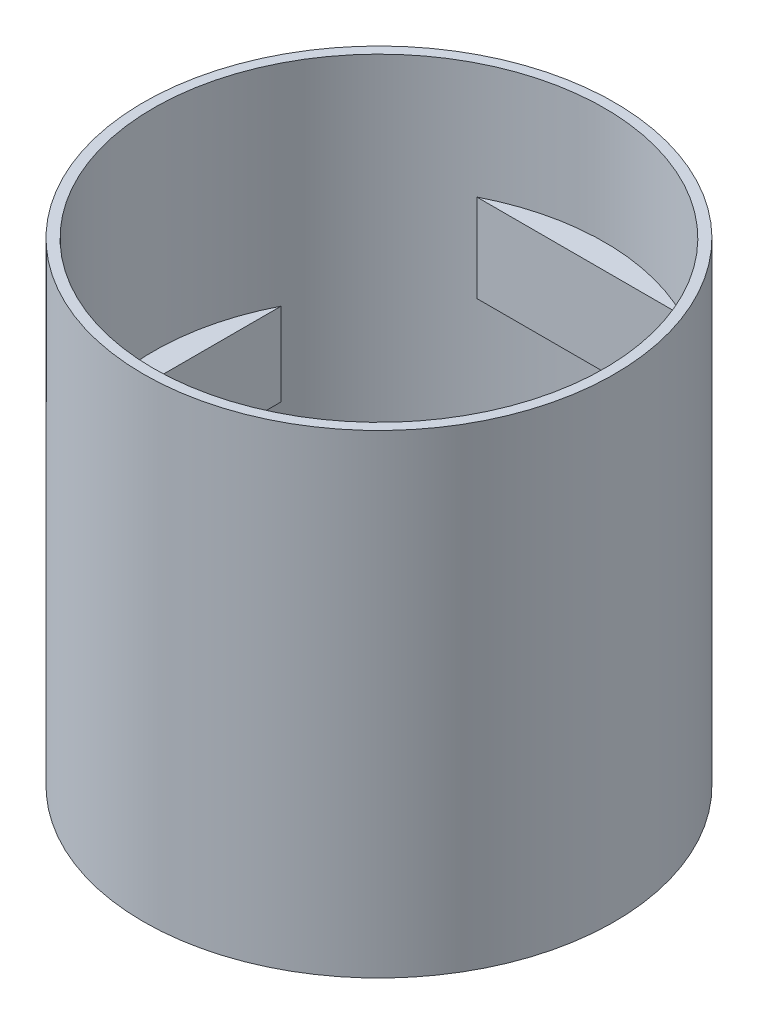
from build123d import *

# Parameters (mm, degrees)
SKETCH_1_R      = 71
SKETCH_1_R_2    = 68
EXTRUDE_1_DEPTH = 143
EXTRUDE_START   = 54.5
EXTRUDE_8_DEPTH = 25
EXTRUDE_START_2 = 81.5
EXTRUDE_9_DEPTH = 26.5


with BuildPart() as part:
    # 草圖1 → 填料-伸長1 (new body)
    with BuildSketch(Plane(origin=(0, 0, 0), x_dir=(1, 0, 0), z_dir=(0, 1, 0))):
        with Locations(Location((0, 0, 0), (0, 0, 270))):
            Circle(SKETCH_1_R)
        with Locations(Location((0, 0, 0), (0, 0, 270))):
            Circle(SKETCH_1_R_2, mode=Mode.SUBTRACT)
    extrude(amount=EXTRUDE_1_DEPTH)

    # 草圖5 → 填料-伸長8 (add)
    with BuildSketch(Plane(origin=(0, 0, 0), x_dir=(1, 0, 0), z_dir=(0, 1, 0)).offset(EXTRUDE_START)):
        with BuildLine():
            Line((-60.519057708, -31.007154887), (-60.519057708, -11))
            Line((-60.519057708, -11), (-60.519057708, -8.25))
            Line((-60.519057708, -8.25), (-60.519057708, 8.25))
            Line((-60.519057708, 8.25), (-60.519057708, 11))
            Line((-60.519057708, 11), (-60.519057708, 31.007154887))
            ThreePointArc((-60.519057708, 31.007154887), (-68, 0), (-60.519057708, -31.007154887))
        make_face()
        with BuildLine():
            Line((60.519057708, -11), (60.519057708, -31.007154887))
            ThreePointArc((60.519057708, -31.007154887), (66.103312792, -15.948418039), (68, 0))
            ThreePointArc((68, 0), (66.103312792, 15.948418039), (60.519057708, 31.007154887))
            Line((60.519057708, 31.007154887), (60.519057708, 11))
            Line((60.519057708, 11), (60.519057708, 8.25))
            Line((60.519057708, 8.25), (60.519057708, -8.25))
            Line((60.519057708, -8.25), (60.519057708, -11))
        make_face()
    extrude(amount=EXTRUDE_8_DEPTH)

    # 草圖5<10> → 填料-伸長9 (add)
    with BuildSketch(Plane(origin=(0, 0, 0), x_dir=(1, 0, 0), z_dir=(0, 1, 0)).offset(EXTRUDE_START_2)):
        with BuildLine():
            Line((-11, -60.519057708), (-31.007154887, -60.519057708))
            ThreePointArc((-31.007154887, -60.519057708), (0, -68), (31.007154887, -60.519057708))
            Line((31.007154887, -60.519057708), (11, -60.519057708))
            Line((11, -60.519057708), (8.25, -60.519057708))
            Line((8.25, -60.519057708), (-8.25, -60.519057708))
            Line((-8.25, -60.519057708), (-11, -60.519057708))
        make_face()
        with BuildLine():
            ThreePointArc((31.007154887, 60.519057708), (0, 68), (-31.007154887, 60.519057708))
            Line((-31.007154887, 60.519057708), (-11, 60.519057708))
            Line((-11, 60.519057708), (-8.25, 60.519057708))
            Line((-8.25, 60.519057708), (8.25, 60.519057708))
            Line((8.25, 60.519057708), (11, 60.519057708))
            Line((11, 60.519057708), (31.007154887, 60.519057708))
        make_face()
    extrude(amount=EXTRUDE_9_DEPTH)


solid = part.part
